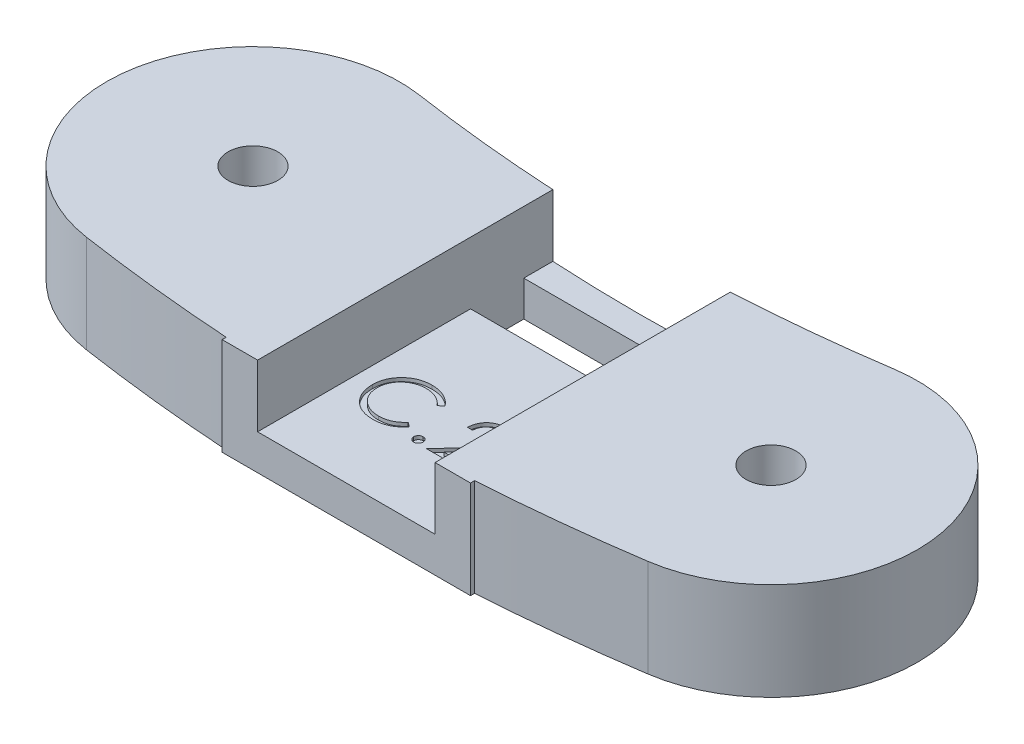
from build123d import *

# Parameters (mm, degrees)
SKETCH2_R                = 1.4
BOSS_EXTRUDE1_DEPTH      = 14
BOSS_EXTRUDE2_REACH      = 34.049
BOSS_EXTRUDE2_END_RADIUS = 107
SKETCH3_W                = 14
SKETCH3_H                = 14
SKETCH19_W               = 15.846179349
SKETCH19_H               = 3
CUT_EXTRUDE4_DEPTH       = 22
CUT_EXTRUDE8_DEPTH       = 33.049477443
SKETCH25_W               = 10
SKETCH25_H               = 3
CUT_EXTRUDE9_DEPTH       = 2
CUT_EXTRUDE10_DEPTH      = 0.2


with BuildPart() as part:
    # Sketch2 → Boss-Extrude1 (new body)
    with BuildSketch(Plane(origin=(0, 0, 0), x_dir=(1, 0, 0), z_dir=(0, 1, 0))):
        with BuildLine():
            ThreePointArc((-13.376751707, 15.494064366), (0, 14.5), (13.376751707, 15.494064366))
            ThreePointArc((13.376751707, 15.494064366), (22.755560222, 8.554111135), (15.815606991, -0.82469738))
            ThreePointArc((15.815606991, -0.82469738), (0, -2), (-15.815606991, -0.82469738))
            ThreePointArc((-15.815606991, -0.82469738), (-22.755560222, 8.554111135), (-13.376751707, 15.494064366))
        make_face()
        with Locations(Location((-14.596179349, 7.334683493, 0), (0, 0, 270))):
            Circle(SKETCH2_R, mode=Mode.SUBTRACT)
        with Locations(Location((14.596179349, 7.334683493, 0), (0, 0, 270))):
            Circle(SKETCH2_R, mode=Mode.SUBTRACT)
    extrude(amount=BOSS_EXTRUDE1_DEPTH)

    # Boss-Extrude2: up to this cylinder (the profile starts outside it)
    boss_extrude2_end = Plane(origin=(0, 7, -105), z_dir=(0, -1, 0)) * Cylinder(BOSS_EXTRUDE2_END_RADIUS, 283.098, mode=Mode.PRIVATE)
    # Sketch3 → Boss-Extrude2 (add, up to the surface)
    with BuildSketch(Plane.XY.offset(2), mode=Mode.PRIVATE) as boss_extrude2_sk1:
        with Locations((0, 7)):
            Rectangle(SKETCH3_W, SKETCH3_H)
    boss_extrude2_tool1 = extrude(boss_extrude2_sk1.sketch, amount=-BOSS_EXTRUDE2_REACH, mode=Mode.PRIVATE) - boss_extrude2_end
    add(boss_extrude2_tool1.solids().sort_by_distance((0, 7, 2))[0])
    add(boss_extrude2_tool1.solids().sort_by_distance((0, 7, 2))[1])

    # Sketch19 → Cut-Extrude4 (cut)
    with BuildSketch(Plane.XY.offset(2)):
        with Locations((-14.923089674, 7)):
            Rectangle(SKETCH19_W, SKETCH19_H)
    cut_extrude4 = extrude(amount=-CUT_EXTRUDE4_DEPTH, mode=Mode.SUBTRACT)

    # Mirror2: Cut-Extrude4 across plane
    add(cut_extrude4.mirror(Plane(origin=(0, 0, 0), x_dir=(0, 0, 1), z_dir=(1, 0, 0))), mode=Mode.SUBTRACT)

    # Sketch24 → Cut-Extrude8 (cut, through all)
    with BuildSketch(Plane.XY.offset(2)):
        Polygon((-5, 8.5), (-7, 8.5), (-7, 5.5), (-5, 5.5), (-5, 2), (5, 2), (5, 5.5), (7, 5.5), (7, 8.5), (5, 8.5), (5, 12), (-5, 12), align=None)
    extrude(amount=-CUT_EXTRUDE8_DEPTH, mode=Mode.SUBTRACT)


with BuildPart() as cut_extrude8_kept_piece:
    # of the separate pieces the step leaves, the one the design keeps (cut_extrude8_pieces_kept)
    add(part.part.solids().sort_by_distance((15.815606991, 0, 0.82469738))[0])

    # Sketch25 → Cut-Extrude9 (cut)
    with BuildSketch(Plane(origin=(0, 2, 0), x_dir=(1, 0, 0), z_dir=(0, 1, 0))):
        with Locations((0, 11.5)):
            Rectangle(SKETCH25_W, SKETCH25_H)
    extrude(amount=-CUT_EXTRUDE9_DEPTH, mode=Mode.SUBTRACT)

    # Sketch26 → Cut-Extrude10 (cut)
    with BuildSketch(Plane(origin=(0, 2, 0), x_dir=(1, 0, 0), z_dir=(0, 1, 0))):
        with BuildLine():
            Line((-0.97295868, 4.527995652), (-1.222277591, 4.337190364))
            add(Edge.make_bspline(
                [(-1.222277591, 4.337190364), (-1.240062932, 4.358386636), (-1.27539383, 4.40049341), (-1.332234678, 4.459620568), (-1.391472597, 4.515015484), (-1.453084943, 4.566942046), (-1.518180716, 4.613584398), (-1.585183012, 4.657373184), (-1.655212667, 4.696623203), (-1.75205174, 4.744214627), (-1.878732289, 4.79387721), (-2.038203321, 4.835517998), (-2.204674103, 4.862025779), (-2.318246212, 4.864896743), (-2.376013568, 4.86635703)],
                knots=[0, 0, 0, 0, 0.757959112, 1.505699292, 2.245454638, 2.979532153, 3.711538275, 4.438200793, 5.171680507, 5.909471876, 7.393775596, 8.890124382, 10.418191784, 12, 12, 12, 12], degree=3))
            add(Edge.make_bspline(
                [(-2.376013568, 4.86635703), (-2.407839133, 4.865990579), (-2.47119489, 4.865261076), (-2.565218863, 4.855637084), (-2.65748713, 4.842110486), (-2.747939675, 4.822039657), (-2.836461359, 4.796664496), (-2.923630895, 4.76634287), (-3.008186225, 4.728828123), (-3.091297055, 4.687364201), (-3.170925339, 4.640530734), (-3.246268132, 4.589446479), (-3.317050646, 4.534683084), (-3.383328873, 4.476035295), (-3.445170569, 4.41376723), (-3.502127629, 4.347215292), (-3.554002966, 4.276592249), (-3.601824839, 4.202829372), (-3.644653533, 4.126141518), (-3.68051278, 4.046244847), (-3.712267427, 3.964507554), (-3.737394597, 3.880006144), (-3.757283266, 3.793335206), (-3.771006217, 3.704262134), (-3.780520759, 3.61297301), (-3.781246634, 3.55109742), (-3.781612527, 3.519907711)],
                knots=[0, 0, 0, 0, 1.054917814, 2.100044995, 3.131103042, 4.146048494, 5.169673617, 6.183595914, 7.203665975, 8.234915748, 9.262203917, 10.264457458, 11.251630812, 12.227803204, 13.197192746, 14.159520551, 15.12972552, 16.100847026, 17.073214652, 18.039054194, 19.002613845, 19.979014051, 20.95965708, 21.949030935, 22.966165397, 24, 24, 24, 24], degree=3))
            add(Edge.make_bspline(
                [(-3.781612527, 3.519907711), (-3.780467876, 3.472980014), (-3.778220508, 3.380843705), (-3.758219519, 3.245887508), (-3.727825615, 3.116600897), (-3.682272913, 2.99379204), (-3.626103488, 2.875946601), (-3.555128077, 2.765058498), (-3.472925932, 2.659452043), (-3.378334137, 2.561623084), (-3.274551718, 2.472257061), (-3.163201827, 2.393561891), (-3.044561795, 2.327961962), (-2.919941566, 2.273373782), (-2.788382162, 2.231412322), (-2.650120163, 2.20187201), (-2.505456282, 2.182602317), (-2.406605469, 2.180757472), (-2.356297022, 2.179818569)],
                knots=[0, 0, 0, 0, 1.029171465, 2.020641659, 2.987623507, 3.938342917, 4.889210282, 5.84687017, 6.821220943, 7.821438502, 8.827599549, 9.822697543, 10.807740252, 11.797342354, 12.80366471, 13.83203677, 14.896651826, 16, 16, 16, 16], degree=3))
            add(Edge.make_bspline(
                [(-2.356297022, 2.179818569), (-2.300868154, 2.181350533), (-2.191770882, 2.184365806), (-2.031779887, 2.209910268), (-1.878621728, 2.251328522), (-1.732288167, 2.309293065), (-1.593191738, 2.384645148), (-1.461114768, 2.475992508), (-1.335945772, 2.584204067), (-1.260678966, 2.666829476), (-1.222277591, 2.708985235)],
                knots=[0, 0, 0, 0, 1.028121516, 2.023589091, 2.998037872, 3.967518031, 4.937445131, 5.927275754, 6.942489185, 8, 8, 8, 8], degree=3))
            Line((-1.222277591, 2.708985235), (-0.97295868, 2.520088))
            add(Edge.make_bspline(
                [(-0.97295868, 2.520088), (-0.993022966, 2.494199547), (-1.03305543, 2.442546646), (-1.097878059, 2.369728738), (-1.166165322, 2.301235791), (-1.23842443, 2.23762002), (-1.313824141, 2.177608469), (-1.39371831, 2.122906094), (-1.477056647, 2.072749363), (-1.563556782, 2.02682351), (-1.653126809, 1.98607715), (-1.745659403, 1.95119409), (-1.840755711, 1.921145083), (-1.93842008, 1.896423683), (-2.038855088, 1.877127771), (-2.141698303, 1.864228495), (-2.24717169, 1.855391187), (-2.318329265, 1.85458572), (-2.354388969, 1.854177543)],
                knots=[0, 0, 0, 0, 0.986787822, 1.968848986, 2.935600012, 3.899624008, 4.868462664, 5.837806735, 6.815139263, 7.798259679, 8.787526145, 9.778297419, 10.776456485, 11.791383307, 12.812564526, 13.85620153, 14.913611965, 16, 16, 16, 16], degree=3))
            add(Edge.make_bspline(
                [(-2.354388969, 1.854177543), (-2.388537153, 1.854415208), (-2.456060957, 1.85488516), (-2.555754825, 1.862498055), (-2.652809659, 1.872884602), (-2.746948069, 1.888523864), (-2.838683775, 1.906979087), (-2.927185163, 1.931718012), (-3.013323103, 1.95943047), (-3.096751527, 1.992001423), (-3.177541397, 2.028755388), (-3.25543214, 2.070294874), (-3.330387933, 2.116270565), (-3.403145707, 2.165669039), (-3.472630658, 2.22007702), (-3.539444928, 2.278738896), (-3.603963174, 2.341456948), (-3.643879895, 2.386682422), (-3.663949265, 2.409420933)],
                knots=[0, 0, 0, 0, 1.114604814, 2.203992996, 3.262667896, 4.300477797, 5.318619304, 6.316056647, 7.298880507, 8.271930387, 9.238335007, 10.195173496, 11.151986948, 12.108099108, 13.064862484, 14.031167946, 15.010108607, 16, 16, 16, 16], degree=3))
            add(Edge.make_bspline(
                [(-3.663949265, 2.409420933), (-3.696094456, 2.448919011), (-3.759996753, 2.527438313), (-3.841753623, 2.654697738), (-3.911737477, 2.787565328), (-3.968321348, 2.926739121), (-4.012556113, 3.071906822), (-4.043200483, 3.22314161), (-4.063113724, 3.380302243), (-4.065390914, 3.487197044), (-4.066548424, 3.541532311)],
                knots=[0, 0, 0, 0, 0.994628077, 1.977248131, 2.950237994, 3.925870899, 4.908910175, 5.911660606, 6.938484602, 8, 8, 8, 8], degree=3))
            add(Edge.make_bspline(
                [(-4.066548424, 3.541532311), (-4.065137641, 3.598641901), (-4.062362014, 3.711001454), (-4.038780114, 3.875896397), (-4.000844492, 4.033876595), (-3.946963029, 4.184647134), (-3.878650317, 4.329001031), (-3.794261889, 4.465835553), (-3.694778124, 4.596025793), (-3.580979259, 4.717596317), (-3.456186034, 4.828757015), (-3.322546824, 4.926552643), (-3.1803232, 5.007939247), (-3.031082006, 5.07597148), (-2.87370571, 5.128263243), (-2.708530082, 5.164869348), (-2.535865495, 5.187654161), (-2.418061723, 5.190534528), (-2.358205075, 5.191998056)],
                knots=[0, 0, 0, 0, 1.032925535, 2.032216505, 3.007276963, 3.968222605, 4.92396291, 5.891752235, 6.871517503, 7.883894988, 8.900124299, 9.891468569, 10.874487609, 11.85992873, 12.854644235, 13.869047385, 14.917252991, 16, 16, 16, 16], degree=3))
            add(Edge.make_bspline(
                [(-2.358205075, 5.191998056), (-2.321724804, 5.191560688), (-2.249515781, 5.190694961), (-2.142697304, 5.182252961), (-2.038700336, 5.168179904), (-1.93745323, 5.149024612), (-1.838463429, 5.125250828), (-1.742487496, 5.0942807), (-1.648962258, 5.058868989), (-1.558477563, 5.018085238), (-1.47146755, 4.972304694), (-1.387959318, 4.922034807), (-1.308616196, 4.867337898), (-1.232879884, 4.80867916), (-1.162017321, 4.74481761), (-1.094016551, 4.677509791), (-1.031186859, 4.604816964), (-0.992403603, 4.553649631), (-0.97295868, 4.527995652)],
                knots=[0, 0, 0, 0, 1.096760587, 2.17092713, 3.219439832, 4.250915756, 5.268269357, 6.278326846, 7.281116186, 8.274029601, 9.260640565, 10.235837813, 11.203064059, 12.156899882, 13.114053108, 14.069676657, 15.032185724, 16, 16, 16, 16], degree=3))
        make_face()
        with BuildLine():
            add(Edge.make_bspline(
                [(-0.097798424, 2.424049338), (-0.080118017, 2.422998715), (-0.045457647, 2.420939092), (0.004652134, 2.406808824), (0.050004432, 2.381718468), (0.09040154, 2.348278662), (0.123699558, 2.30773331), (0.149684078, 2.262742736), (0.163691257, 2.212213434), (0.165735877, 2.177352229), (0.166784909, 2.159466005)],
                knots=[0, 0, 0, 0, 1.020151414, 1.999887582, 2.974338812, 3.990962822, 5.007586832, 5.987933904, 6.967670073, 8, 8, 8, 8], degree=3))
            add(Edge.make_bspline(
                [(0.166784909, 2.159466005), (0.165700329, 2.142009556), (0.163561552, 2.107585694), (0.149716186, 2.05743751), (0.123501526, 2.012418818), (0.090631211, 1.971323307), (0.049994446, 1.93781266), (0.004544914, 1.912935769), (-0.045340013, 1.897793759), (-0.080098392, 1.895864904), (-0.097798424, 1.894882671)],
                knots=[0, 0, 0, 0, 1.009421747, 1.99056486, 2.972319754, 3.999869655, 5.017953583, 5.993804169, 6.978383603, 8, 8, 8, 8], degree=3))
            add(Edge.make_bspline(
                [(-0.097798424, 1.894882671), (-0.11551121, 1.895829363), (-0.150091208, 1.897677553), (-0.199789931, 1.91324667), (-0.245516252, 1.937579381), (-0.286145105, 1.971385792), (-0.319290719, 2.01220735), (-0.344350887, 2.057747551), (-0.359400523, 2.107442141), (-0.361379793, 2.141981281), (-0.362381757, 2.159466005)],
                knots=[0, 0, 0, 0, 1.022052826, 1.995314843, 2.982371812, 4.00089066, 5.028879526, 6.005146991, 6.990147033, 8, 8, 8, 8], degree=3))
            add(Edge.make_bspline(
                [(-0.362381757, 2.159466005), (-0.361418282, 2.177381513), (-0.359537213, 2.212359345), (-0.344319293, 2.262432821), (-0.319485158, 2.307942763), (-0.285915978, 2.348216803), (-0.245526081, 2.381950999), (-0.199900238, 2.406502633), (-0.149971512, 2.421053578), (-0.115491068, 2.423033433), (-0.097798424, 2.424049338)],
                knots=[0, 0, 0, 0, 1.032775665, 2.016367738, 2.991239715, 4.008302682, 5.025365648, 6.011011707, 6.979408107, 8, 8, 8, 8], degree=3))
        make_face()
        with BuildLine():
            Line((0.980887473, 4.133664723), (0.695951576, 4.133664723))
            add(Edge.make_bspline(
                [(0.695951576, 4.133664723), (0.697808636, 4.171466171), (0.701455853, 4.245707209), (0.718535801, 4.353951038), (0.742975026, 4.457415034), (0.777529416, 4.555268456), (0.820442968, 4.648376517), (0.871905207, 4.736369389), (0.932859629, 4.818911395), (1.001990023, 4.895237346), (1.077073003, 4.9652575), (1.158086248, 5.025723327), (1.243217094, 5.0768115), (1.332207263, 5.119520913), (1.426060774, 5.151579201), (1.523925938, 5.175365974), (1.626232726, 5.189677374), (1.695937603, 5.191215694), (1.731388275, 5.191998056)],
                knots=[0, 0, 0, 0, 1.10065271, 2.161652631, 3.183658789, 4.190468796, 5.17591951, 6.163126047, 7.15150782, 8.156236427, 9.156009102, 10.134482811, 11.092018607, 12.041330605, 13.001268258, 13.972401359, 14.968799086, 16, 16, 16, 16], degree=3))
            add(Edge.make_bspline(
                [(1.731388275, 5.191998056), (1.766202671, 5.191183028), (1.834611715, 5.189581526), (1.934453685, 5.175828307), (2.029501659, 5.154287663), (2.119569847, 5.124065821), (2.203939634, 5.083439947), (2.283244825, 5.034637894), (2.35842956, 4.978195619), (2.426108571, 4.911743945), (2.488255186, 4.840803211), (2.541869375, 4.765067755), (2.587782744, 4.686845475), (2.626052997, 4.605539892), (2.654225351, 4.520385459), (2.675614154, 4.432621925), (2.687704022, 4.341340846), (2.689559514, 4.279558471), (2.690502858, 4.248147896)],
                knots=[0, 0, 0, 0, 1.111607364, 2.184268762, 3.212621178, 4.221274766, 5.211760367, 6.196651075, 7.1921475, 8.207485113, 9.220403448, 10.201281604, 11.166441695, 12.114753415, 13.065576456, 14.026450734, 14.996634279, 16, 16, 16, 16], degree=3))
            add(Edge.make_bspline(
                [(2.690502858, 4.248147896), (2.688966827, 4.203926646), (2.685921719, 4.116260166), (2.659873678, 3.987432398), (2.619191486, 3.862615511), (2.570208169, 3.762160958), (2.52079388, 3.681213431), (2.476264499, 3.614566821), (2.424135706, 3.54280686), (2.363648783, 3.466173847), (2.296054963, 3.384067526), (2.220742, 3.296537497), (2.137172842, 3.204488106), (2.078518344, 3.141618025), (2.048125054, 3.109040324)],
                knots=[0, 0, 0, 0, 1.184426356, 2.348067706, 3.509069118, 4.696110526, 5.333549288, 6.050745305, 6.844228056, 7.710549037, 8.667450064, 9.695053472, 10.805634456, 12, 12, 12, 12], degree=3))
            Line((2.048125054, 3.109040324), (1.253739036, 2.261228825))
            Line((1.253739036, 2.261228825), (2.731207986, 2.261228825))
            Line((2.731207986, 2.261228825), (2.731207986, 1.9355878))
            Line((2.731207986, 1.9355878), (0.573836191, 1.9355878))
            Line((0.573836191, 1.9355878), (1.80516632, 3.249600219))
            add(Edge.make_bspline(
                [(1.80516632, 3.249600219), (1.835145474, 3.280895112), (1.892729294, 3.341006195), (1.974174918, 3.428765881), (2.047326, 3.510181535), (2.112656063, 3.585099333), (2.168747886, 3.654615112), (2.218524839, 3.716477451), (2.258407911, 3.773404702), (2.301692592, 3.83939083), (2.343615275, 3.919956289), (2.379640055, 4.01841185), (2.401606382, 4.11976443), (2.404241482, 4.188255563), (2.405566961, 4.222707191)],
                knots=[0, 0, 0, 0, 1.329631726, 2.553950428, 3.673215718, 4.687767853, 5.603093632, 6.413772471, 7.123043292, 7.734684054, 8.834405432, 9.900288307, 10.943827018, 12, 12, 12, 12], degree=3))
            add(Edge.make_bspline(
                [(2.405566961, 4.222707191), (2.404990252, 4.244371031), (2.403853669, 4.287066299), (2.393822757, 4.34966438), (2.378663941, 4.410048176), (2.356942171, 4.468403423), (2.328270343, 4.524143408), (2.293369491, 4.577335979), (2.253101362, 4.628760969), (2.206518425, 4.676978603), (2.155345118, 4.721139411), (2.10128462, 4.760259117), (2.044089168, 4.792951739), (1.983999914, 4.819751912), (1.921184381, 4.840775293), (1.855521077, 4.855342719), (1.787191434, 4.864488972), (1.740533905, 4.865726471), (1.716759869, 4.86635703)],
                knots=[0, 0, 0, 0, 0.991446411, 1.95395049, 2.89581595, 3.838931463, 4.798493298, 5.75982156, 6.748411868, 7.785213223, 8.824556874, 9.840280684, 10.836137867, 11.835679398, 12.848801643, 13.863922112, 14.911575587, 16, 16, 16, 16], degree=3))
            add(Edge.make_bspline(
                [(1.716759869, 4.86635703), (1.691930614, 4.865708394), (1.643170056, 4.864434579), (1.571579219, 4.85552402), (1.503284264, 4.840151722), (1.438113394, 4.819127167), (1.375956342, 4.792404055), (1.317115387, 4.759119401), (1.261722623, 4.719401518), (1.20967392, 4.674370441), (1.161718739, 4.624234832), (1.119584787, 4.568345794), (1.082769289, 4.507723781), (1.050648056, 4.442532368), (1.024562537, 4.37218001), (1.00462975, 4.296916449), (0.988857397, 4.217068482), (0.983588239, 4.161927726), (0.980887473, 4.133664723)],
                knots=[0, 0, 0, 0, 1.031018746, 2.02475058, 2.990194455, 3.934040569, 4.864654155, 5.795059489, 6.735614925, 7.690564532, 8.649604399, 9.611025574, 10.590972636, 11.591080095, 12.624614302, 13.701020113, 14.821632451, 16, 16, 16, 16], degree=3))
        make_face()
    extrude(amount=-CUT_EXTRUDE10_DEPTH, mode=Mode.SUBTRACT)


solid = cut_extrude8_kept_piece.part
